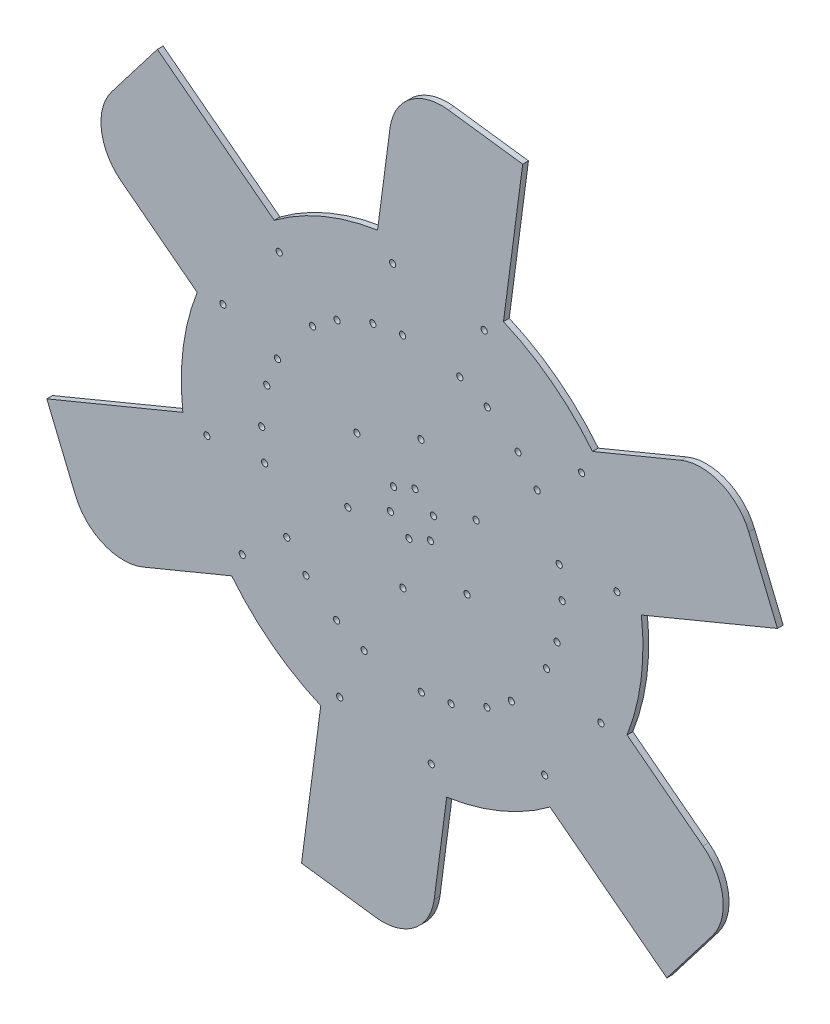
from build123d import *

# Parameters (mm, degrees)
SKETCH1_R            = 127
BOSS_EXTRUDE1_DEPTH  = 3.175
M3_CLEARANCE_HOLE1_D = 3.4
CIRPATTERN1_COUNT    = 6
BOSS_EXTRUDE2_DEPTH  = 3.175
CIRPATTERN2_COUNT    = 6


with BuildPart() as part:
    # Sketch1 → Boss-Extrude1 (new body)
    with BuildSketch(Plane.XY):
        Circle(SKETCH1_R)
    extrude(amount=BOSS_EXTRUDE1_DEPTH)

    # M3 Clearance Hole1 (through all)
    with Locations(Plane(origin=(0, 0, 0), x_dir=(-1, 0, 0), z_dir=(0, 0, -1))):
        with Locations((-58.2494214, 58.493652703), (-82.549819355, -0.172697611), (-93.238867767, 66.113565457), (-112.679186132, 19.180485205), (-11.733270063, 4.860079591), (-68.767621753, 45.667457762), (-80.917820731, 16.334282605), (-35.199810189, 14.580238773)):
            m3_clearance_hole1 = Hole(M3_CLEARANCE_HOLE1_D / 2)

    # CirPattern1: M3 Clearance Hole1 ×6 about axis
    cirpattern1_axis = Axis((-0.09749486, -0.040383693, 0), (0, 0, 1))
    for i in range(1, CIRPATTERN1_COUNT):
        add(m3_clearance_hole1.rotate(cirpattern1_axis, i * 360 / CIRPATTERN1_COUNT), mode=Mode.SUBTRACT)

    # Sketch6 → Boss-Extrude2 (add)
    with BuildSketch(Plane(origin=(0, 0, 0), x_dir=(-1, 0, 0), z_dir=(0, 0, -1))):
        with BuildLine():
            Line((-97.979344732, 78.730580539), (-147.8457425, 99.385918801))
            ThreePointArc((-147.8457425, 99.385918801), (-169.716100659, 99.385918801), (-185.180779221, 83.92124024))
            Line((-185.180779221, 83.92124024), (-200.976037892, 45.788112535))
            Line((-200.976037892, 45.788112535), (-124.709782483, 14.197595193))
            Line((-124.709782483, 14.197595193), (-97.979344732, 78.730580539))
        make_face()
    boss_extrude2 = extrude(amount=-BOSS_EXTRUDE2_DEPTH)

    # CirPattern2: Boss-Extrude2 ×6 about axis
    cirpattern2_axis = Axis((0, 0, 0), (0, 0, 1))
    for i in range(1, CIRPATTERN2_COUNT):
        add(boss_extrude2.rotate(cirpattern2_axis, i * 360 / CIRPATTERN2_COUNT))


solid = part.part
